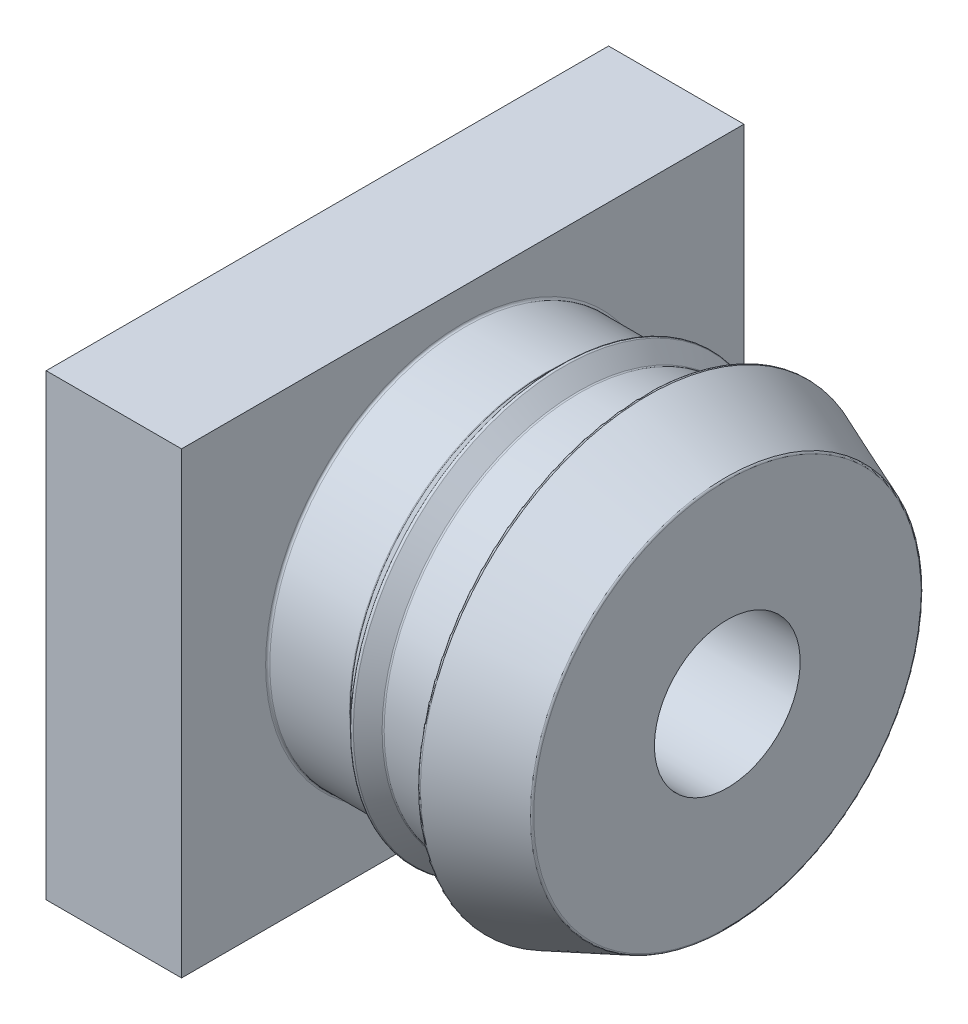
from build123d import *

# Parameters (mm, degrees)
SKETCH2_W               = 27
SKETCH2_H               = 22
SKETCH2_R               = 3.5
BOSS_EXTRUDE1_DEPTH     = 1.5
BOSS_EXTRUDE2_DEPTH     = 2
SKETCH2_4_R             = 0.9
BOSS_EXTRUDE3_DEPTH     = 5
SKETCH2_5_R             = 3.5
SKETCH2_5_W             = 2.46
SKETCH2_5_H             = 4.35
CUT_EXTRUDE1_DEPTH      = 22.553190019
BOSS_EXTRUDE4_START     = 1.5
SKETCH2_6_W             = 27
SKETCH2_6_H             = 22
SKETCH2_6_W_2           = 18.58
SKETCH2_6_H_2           = 14.05
BOSS_EXTRUDE4_DEPTH     = 5
FILLET1_R               = 0.1
FILLET4_R               = 0.2
FILLET5_R               = 0.2
CUT_SWEEP1_PROFILE_R    = 0.889
FILLET6_R               = 0.2
CUT_EXTRUDE2_DEPTH      = 7
CUT_EXTRUDE2_DEPTH_BACK = 7


with BuildPart() as part:
    # Sketch1 → Revolve1 (revolve)
    with BuildSketch(Plane(origin=(0, 0, 0), x_dir=(1, 0, 0), z_dir=(0, 1, 0))):
        Polygon((0, 0), (-12.7, 0), (-12.7, 9.365), (-8.73, 9.365), (-7.94, 10.155), (-7.15, 9.365), (-3.97, 9.365), (-3.97, 10.955), (0, 9.365), align=None)
    revolve(axis=Axis((0, 0, 0), (-1, 0, 0)))

    # Sketch2 → Boss-Extrude1 (add)
    with BuildSketch(Plane.ZY.offset(12.7)):
        Rectangle(SKETCH2_W, SKETCH2_H)
        Circle(SKETCH2_R, mode=Mode.SUBTRACT)
    extrude(amount=BOSS_EXTRUDE1_DEPTH)

    # Sketch2<3> → Boss-Extrude2 (add)
    with BuildSketch(Plane.ZY.offset(12.7)):
        with BuildLine():
            ThreePointArc((-8.143254878, -4.625), (-7.532295819, -5.564866997), (-6.813413242, -6.425))
            Line((-6.813413242, -6.425), (6.813413242, -6.425))
            ThreePointArc((6.813413242, -6.425), (7.532295819, -5.564866997), (8.143254878, -4.625))
            Line((8.143254878, -4.625), (-8.143254878, -4.625))
        make_face()
        with BuildLine():
            ThreePointArc((8.143254878, -4.625), (7.532295819, -5.564866997), (6.813413242, -6.425))
            Line((6.813413242, -6.425), (8.59, -6.425))
            Line((8.59, -6.425), (8.59, -4.625))
            Line((8.59, -4.625), (8.143254878, -4.625))
        make_face()
        with BuildLine():
            Line((-8.59, -4.625), (-8.59, -6.425))
            Line((-8.59, -6.425), (-6.813413242, -6.425))
            ThreePointArc((-6.813413242, -6.425), (-7.532295819, -5.564866997), (-8.143254878, -4.625))
            Line((-8.143254878, -4.625), (-8.59, -4.625))
        make_face()
    extrude(amount=BOSS_EXTRUDE2_DEPTH)

    # Sketch2<4> → Boss-Extrude3 (add)
    with BuildSketch(Plane.ZY.offset(12.7)):
        with Locations((6.19, 3.935)):
            Circle(SKETCH2_4_R)
        with Locations((-6.19, 3.935)):
            Circle(SKETCH2_4_R)
    extrude(amount=BOSS_EXTRUDE3_DEPTH)

    # Sketch2<5> → Cut-Extrude1 (cut, through all)
    # profile 1 of 2: a face of its own
    with BuildSketch(Plane.ZY.offset(12.7)):
        Circle(SKETCH2_5_R)
        with Locations((-0.31, 0.56)):
            Rectangle(SKETCH2_5_W, SKETCH2_5_H, mode=Mode.SUBTRACT)
    # profile 2 of 2: a face of its own
    with BuildSketch(Plane.ZY.offset(12.7)):
        with Locations((-0.31, 0.56)):
            Rectangle(SKETCH2_5_W, SKETCH2_5_H)
    extrude(amount=-CUT_EXTRUDE1_DEPTH, mode=Mode.SUBTRACT)

    # Sketch2<6> → Boss-Extrude4 (add)
    with BuildSketch(Plane.ZY.offset(12.7).offset(BOSS_EXTRUDE4_START)):
        Rectangle(SKETCH2_6_W, SKETCH2_6_H)
        with Locations((0, -0.4)):
            Rectangle(SKETCH2_6_W_2, SKETCH2_6_H_2, mode=Mode.SUBTRACT)
    extrude(amount=BOSS_EXTRUDE4_DEPTH)

    # Fillet1
    fillet1_edges = [part.edges().sort_by_distance(p)[0] for p in [
        (-3.97, 0, 9.365),
        (-3.97, 0, 10.955),
        (0, 0, 9.365),
        (-12.7, 0, 9.365),
        (-8.73, 0, 9.365),
        (-7.94, 0, 10.155),
        (-7.15, 0, 9.365),
    ]]
    fillet(fillet1_edges, radius=FILLET1_R)

    # Fillet4
    fillet4_edges = [part.edges().sort_by_distance(p)[0] for p in [
        (-17.7, 3.935, 5.29),
        (-17.7, 3.935, -7.09),
    ]]
    fillet(fillet4_edges, radius=FILLET4_R)

    # Fillet5
    fillet5_edges = [part.edges().sort_by_distance(p)[0] for p in [
        (-14.7, -4.625, 0),
        (-14.7, -5.525, -8.59),
        (-14.7, -6.425, 0),
        (-14.7, -5.525, 8.59),
    ]]
    fillet(fillet5_edges, radius=FILLET5_R)

    # Cut-Sweep1: sweep along a path in Sketch6
    with BuildLine(Plane.ZY.offset(19.2)) as cut_sweep1_path:
        Line((-9.29, 8.625), (9.29, 8.625))
        ThreePointArc((9.29, 8.625), (10.704213562, 8.039213562), (11.29, 6.625))
        Line((11.29, 6.625), (11.29, -6.425))
        ThreePointArc((11.29, -6.425), (10.704213562, -7.839213562), (9.29, -8.425))
        Line((9.29, -8.425), (-9.29, -8.425))
        ThreePointArc((-9.29, -8.425), (-10.704213562, -7.839213562), (-11.29, -6.425))
        Line((-11.29, -6.425), (-11.29, 6.625))
        ThreePointArc((-11.29, 6.625), (-10.704213562, 8.039213562), (-9.29, 8.625))
    # Cut-Sweep1 profile (on start of the path) → Cut-Sweep1 (sweep, cut)
    with BuildSketch(Plane(origin=(-19.2, 8.625, -9.29), x_dir=(1, 0, 0), z_dir=(0, 0, 1))):
        Circle(CUT_SWEEP1_PROFILE_R)
    sweep(path=cut_sweep1_path.line, mode=Mode.SUBTRACT)

    # Fillet6
    fillet6_edges = [part.edges().sort_by_distance(p)[0] for p in [
        (-14.2, 3.935, 5.29),
        (-14.2, 3.935, -7.09),
    ]]
    fillet(fillet6_edges, radius=FILLET6_R)

    # Sketch8 → Cut-Extrude2 (cut, two sides: drawn at the far end of the back side and taken through both)
    with BuildSketch(Plane.XY.offset(-CUT_EXTRUDE2_DEPTH_BACK)):
        Polygon((-17.9, -11), (-17.9, -9.834230855), (-15.4, -11), align=None)
    extrude(amount=CUT_EXTRUDE2_DEPTH + CUT_EXTRUDE2_DEPTH_BACK, mode=Mode.SUBTRACT)


solid = part.part
